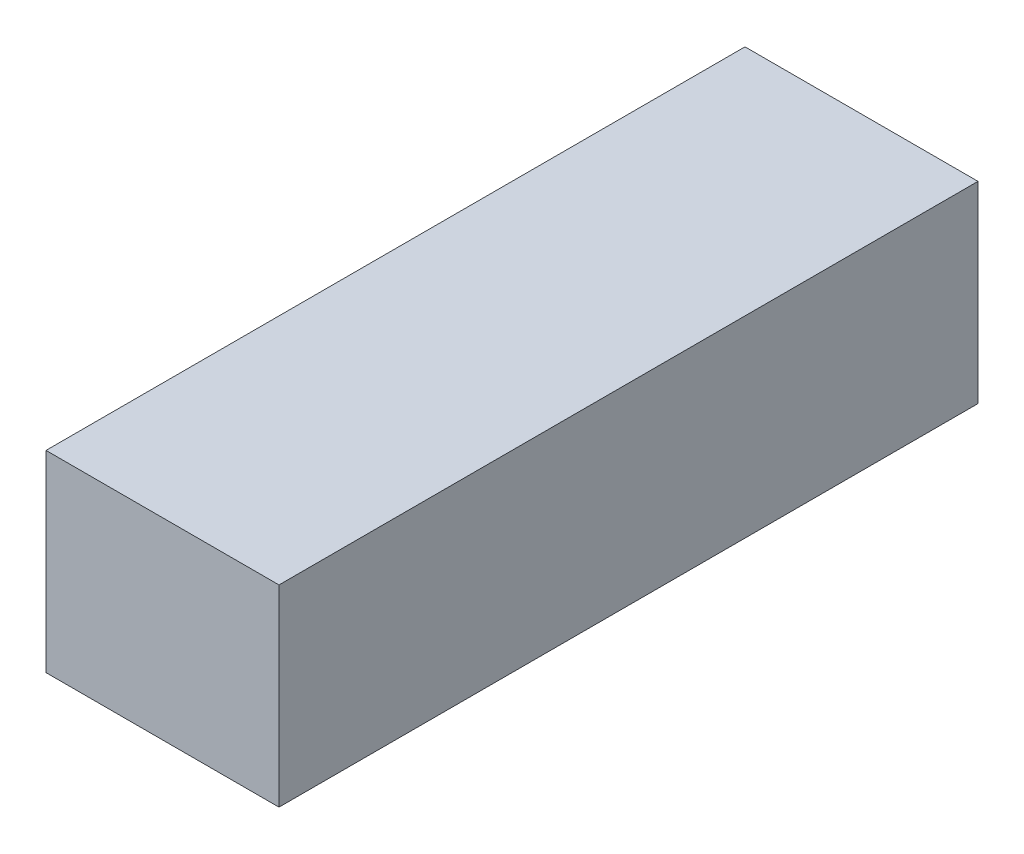
from build123d import *

# Parameters (mm, degrees)
SKETCH1_W           = 46
SKETCH1_H           = 138
BOSS_EXTRUDE1_DEPTH = 38


with BuildPart() as part:
    # Sketch1 → Boss-Extrude1 (new body)
    with BuildSketch(Plane(origin=(0, 0, 0), x_dir=(1, 0, 0), z_dir=(0, 1, 0))):
        with Locations((-23, -69)):
            Rectangle(SKETCH1_W, SKETCH1_H)
    extrude(amount=BOSS_EXTRUDE1_DEPTH)


solid = part.part
